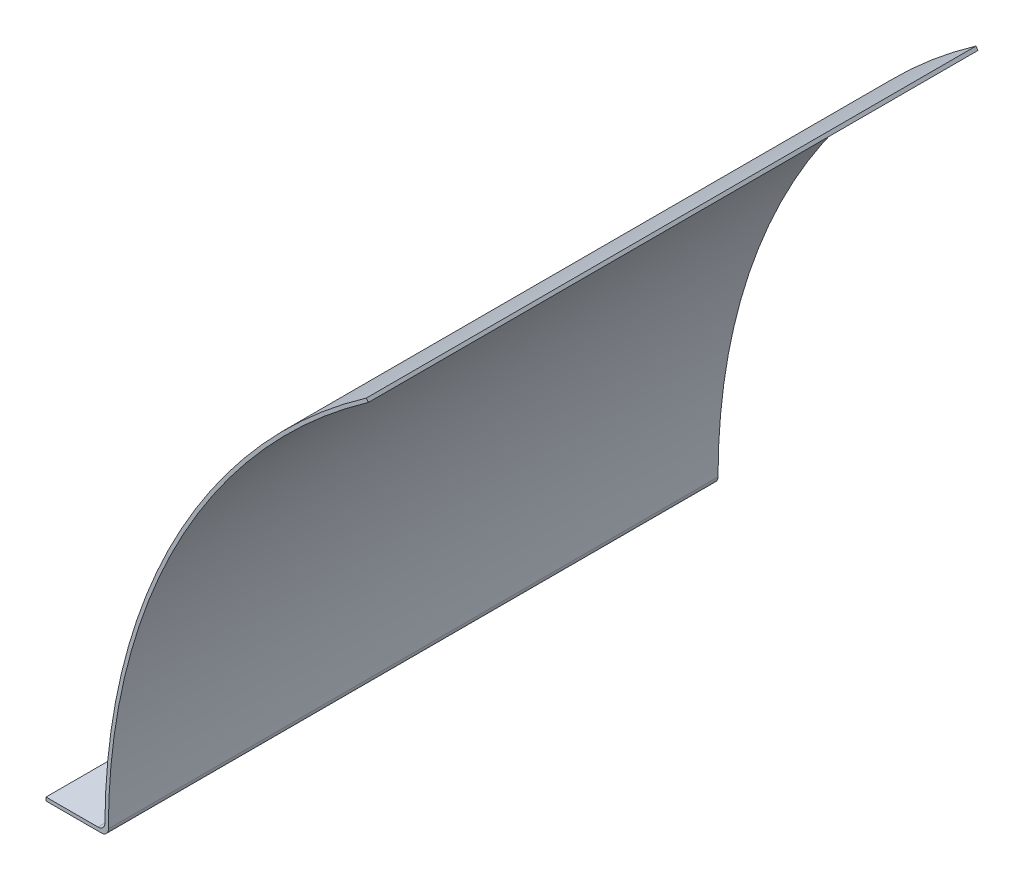
from build123d import *

# Parameters (mm, degrees)
BOSS_EXTRUDE1_DEPTH = 279.4


with BuildPart() as part:
    # Sketch1 → Boss-Extrude1 (new body)
    with BuildSketch(Plane.XY):
        with BuildLine():
            Line((-284.158065608, -1.5875), (-307.975, -1.5875))
            Line((-307.975, -1.5875), (-307.975, -3.175))
            Line((-307.975, -3.175), (-282.575, -3.175))
            ThreePointArc((-282.575, -3.175), (-280.32993597, -2.24506403), (-279.4, 0))
            ThreePointArc((-279.4, 0), (-247.83082679, 129.012562538), (-160.257256316, 228.871081174))
            Line((-160.257256316, 228.871081174), (-161.167808909, 230.171485045))
            ThreePointArc((-161.167808909, 230.171485045), (-248.875564876, 130.441283205), (-280.983115154, 1.56976257))
            ThreePointArc((-280.983115154, 1.56976257), (-281.919281489, -0.663826425), (-284.158065608, -1.5875))
        make_face()
    extrude(amount=BOSS_EXTRUDE1_DEPTH)


solid = part.part
